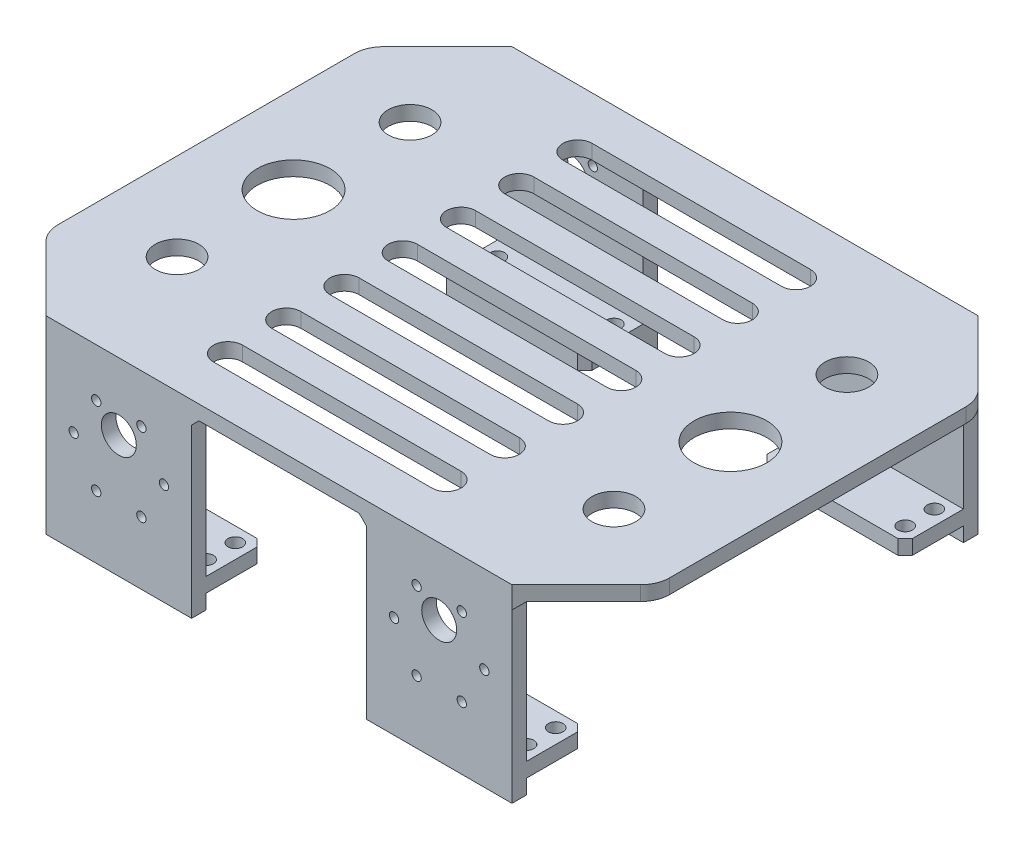
from build123d import *

# Parameters (mm, degrees)
SKETCH1_R               = 18.5
BOSS_EXTRUDE1_DEPTH     = 22.5
SKETCH2_R               = 1.6
CUT_EXTRUDE1_DEPTH      = 3.5
BOSS_EXTRUDE2_DEPTH     = 36.3
BOSS_EXTRUDE3_DEPTH     = 6.3
SKETCH4_R               = 14.5
BOSS_EXTRUDE4_DEPTH     = 37.8
SKETCH5_R               = 5
BOSS_EXTRUDE5_DEPTH     = 3
SKETCH6_R               = 1
BOSS_EXTRUDE6_DEPTH     = 9
SKETCH7_W               = 0.5
SKETCH7_H               = 3
BOSS_EXTRUDE7_DEPTH     = 6.5
CUT_EXTRUDE2_DEPTH      = 0.5
FILLET1_R               = 0.5
CHAMFER1_SIZE           = 0.2
CUT_EXTRUDE3_DEPTH      = 67.7078706
CUT_EXTRUDE3_DEPTH_BACK = 67.7078706
SKETCH9_R               = 1.6
SKETCH10_R              = 1.6
BOSS_EXTRUDE8_DEPTH     = 10
BOSS_EXTRUDE8_2_DEPTH   = 10
BOSS_EXTRUDE8_3_DEPTH   = 10
BOSS_EXTRUDE8_4_DEPTH   = 10
BOSS_EXTRUDE8_5_DEPTH   = 10
BOSS_EXTRUDE8_6_DEPTH   = 10
SKETCH11_W              = 50
SKETCH11_H              = 60
BOSS_EXTRUDE9_DEPTH     = 5
SKETCH13_W              = 56.82563108
SKETCH13_H              = 53.984349526
CUT_EXTRUDE4_DEPTH      = 121
CUT_EXTRUDE5_DEPTH      = 54.194830576
CUT_EXTRUDE5_DEPTH_BACK = 54.194830576
SKETCH14_R              = 1.6
SKETCH14_R_2            = 6
SKETCH15_W              = 160
SKETCH15_H              = 160
BOSS_EXTRUDE10_DEPTH    = 5
CHAMFER2_SIZE           = 2.5
CHAMFER3_SIZE           = 2.5
CUT_EXTRUDE6_DEPTH      = 237.127613802
SKETCH19_W              = 25
SKETCH19_H              = 160
BOSS_EXTRUDE11_DEPTH    = 5
CHAMFER4_SIZE           = 25
SKETCH20_R              = 12.5
SKETCH20_R_2            = 7.5
CUT_EXTRUDE7_DEPTH      = 10
CHAMFER5_SIZE           = 2.5
CHAMFER6_SIZE           = 2.5
FILLET2_R               = 10
BOSS_EXTRUDE12_START    = -5
SKETCH21_W              = 50
SKETCH21_H              = 20
SKETCH21_R              = 2.5
BOSS_EXTRUDE12_DEPTH    = 5
CHAMFER7_SIZE           = 2.5


with BuildPart() as part:
    # Sketch1 → Boss-Extrude1 (new body)
    with BuildSketch(Plane.XY):
        with Locations(Location((0, 0, 0), (0, 0, 180))):
            Circle(SKETCH1_R)
    extrude(amount=BOSS_EXTRUDE1_DEPTH)

    # Sketch2 → Cut-Extrude1 (cut)
    with BuildSketch(Plane.XY.offset(22.5)):
        with Locations((-7.75, 13.423393759)):
            Circle(SKETCH2_R)
        with Locations((7.75, 13.423393759)):
            Circle(SKETCH2_R)
        with Locations((-15.5, 0)):
            Circle(SKETCH2_R)
        with Locations((-7.75, -13.423393759)):
            Circle(SKETCH2_R)
        with Locations((7.75, -13.423393759)):
            Circle(SKETCH2_R)
        with Locations((15.5, 0)):
            Circle(SKETCH2_R)
    extrude(amount=-CUT_EXTRUDE1_DEPTH, mode=Mode.SUBTRACT)

    # Sketch3 → Boss-Extrude2 (add)
    with BuildSketch(Plane.XY.offset(22.5)):
        with BuildLine():
            ThreePointArc((0, 10), (-3, 7), (0, 4))
            Line((0, 4), (0, 10))
        make_face()
        with BuildLine():
            Line((0, 10), (0, 4))
            ThreePointArc((0, 4), (2.121320344, 4.878679656), (3, 7))
            ThreePointArc((3, 7), (2.121320344, 9.121320344), (0, 10))
        make_face()
    extrude(amount=BOSS_EXTRUDE2_DEPTH)

    # Sketch3<3> → Boss-Extrude3 (add)
    with BuildSketch(Plane.XY.offset(22.5)):
        with BuildLine():
            ThreePointArc((0, 13), (-6, 7), (0, 1))
            Line((0, 1), (0, 4))
            ThreePointArc((0, 4), (-3, 7), (0, 10))
            Line((0, 10), (0, 13))
        make_face()
        with BuildLine():
            Line((0, 4), (0, 1))
            ThreePointArc((0, 1), (4.242640687, 2.757359313), (6, 7))
            ThreePointArc((6, 7), (4.242640687, 11.242640687), (0, 13))
            Line((0, 13), (0, 10))
            ThreePointArc((0, 10), (2.121320344, 9.121320344), (3, 7))
            ThreePointArc((3, 7), (2.121320344, 4.878679656), (0, 4))
        make_face()
    extrude(amount=BOSS_EXTRUDE3_DEPTH)

    # Sketch4 → Boss-Extrude4 (add)
    with BuildSketch(Plane(origin=(0, 0, 0), x_dir=(-1, 0, 0), z_dir=(0, 0, -1))):
        with Locations(Location((0, 0, 0), (0, 0, 180))):
            Circle(SKETCH4_R)
    extrude(amount=BOSS_EXTRUDE4_DEPTH)

    # Sketch5 → Boss-Extrude5 (add)
    with BuildSketch(Plane(origin=(0, 0, -37.8), x_dir=(-1, 0, 0), z_dir=(0, 0, -1))):
        Circle(SKETCH5_R)
    extrude(amount=BOSS_EXTRUDE5_DEPTH)

    # Sketch6 → Boss-Extrude6 (add)
    with BuildSketch(Plane(origin=(0, 0, -40.8), x_dir=(-1, 0, 0), z_dir=(0, 0, -1))):
        Circle(SKETCH6_R)
    extrude(amount=BOSS_EXTRUDE6_DEPTH)

    # Sketch7 → Boss-Extrude7 (add)
    with BuildSketch(Plane(origin=(0, 0, -37.8), x_dir=(-1, 0, 0), z_dir=(0, 0, -1))):
        with Locations((-11.75, 0)):
            Rectangle(SKETCH7_W, SKETCH7_H)
        with Locations((11.75, 0)):
            Rectangle(SKETCH7_W, SKETCH7_H)
    extrude(amount=BOSS_EXTRUDE7_DEPTH)

    # Sketch8 → Cut-Extrude2 (cut)
    with BuildSketch(Plane(origin=(12, 0, 0), x_dir=(0, 0, -1), z_dir=(1, 0, 0))):
        with BuildLine():
            Line((42.865122037, -0.320114275), (41.665122037, -0.320114275))
            ThreePointArc((41.665122037, -0.320114275), (41.345007763, 0), (41.665122037, 0.320114275))
            Line((41.665122037, 0.320114275), (42.865122037, 0.320114275))
            ThreePointArc((42.865122037, 0.320114275), (43.185236312, 0), (42.865122037, -0.320114275))
        make_face()
    cut_extrude2 = extrude(amount=-CUT_EXTRUDE2_DEPTH, mode=Mode.SUBTRACT)

    # Mirror2: Cut-Extrude2 across plane
    add(cut_extrude2.mirror(Plane(origin=(0, 0, 0), x_dir=(0, 0, 1), z_dir=(1, 0, 0))), mode=Mode.SUBTRACT)

    # Fillet1
    fillet1_edges = [part.edges().sort_by_distance(p)[0] for p in [
        (11.75, -1.5, -44.3),
        (11.75, 1.5, -44.3),
        (-11.75, 1.5, -44.3),
        (-11.75, -1.5, -44.3),
    ]]
    fillet(fillet1_edges, radius=FILLET1_R)

    # Chamfer1
    chamfer1_edges = [part.edges().sort_by_distance(p)[0] for p in [
        (0, 4, 58.8),
        (0, 1, 28.8),
        (18.5, 0, 22.5),
    ]]
    chamfer(chamfer1_edges, length=CHAMFER1_SIZE)

    # Sketch9 → Cut-Extrude3 (cut, two sides: drawn at the far end of the back side and taken through both)
    with BuildSketch(Plane(origin=(0, 7, 0), x_dir=(1, 0, 0), z_dir=(0, 1, 0)).offset(-CUT_EXTRUDE3_DEPTH_BACK)):
        with Locations(Location((0, -50.8, 0), (0, 0, 270))):
            Circle(SKETCH9_R)
    extrude(amount=CUT_EXTRUDE3_DEPTH + CUT_EXTRUDE3_DEPTH_BACK, mode=Mode.SUBTRACT)



with BuildPart() as body_2:
    # Sketch10 → Boss-Extrude8 (new body)
    with BuildSketch(Plane.XY.offset(22.5)):
        with Locations((-7.75, 13.423393759)):
            Circle(SKETCH10_R)
    extrude(amount=BOSS_EXTRUDE8_DEPTH)


with BuildPart() as body_3:
    # Sketch10 → Boss-Extrude8 2 (new body)
    with BuildSketch(Plane.XY.offset(22.5)):
        with Locations((-15.5, 0)):
            Circle(SKETCH10_R)
    extrude(amount=BOSS_EXTRUDE8_2_DEPTH)


with BuildPart() as body_4:
    # Sketch10 → Boss-Extrude8 3 (new body)
    with BuildSketch(Plane.XY.offset(22.5)):
        with Locations((-7.75, -13.423393759)):
            Circle(SKETCH10_R)
    extrude(amount=BOSS_EXTRUDE8_3_DEPTH)


with BuildPart() as body_5:
    # Sketch10 → Boss-Extrude8 4 (new body)
    with BuildSketch(Plane.XY.offset(22.5)):
        with Locations((7.75, -13.423393759)):
            Circle(SKETCH10_R)
    extrude(amount=BOSS_EXTRUDE8_4_DEPTH)


with BuildPart() as body_6:
    # Sketch10 → Boss-Extrude8 5 (new body)
    with BuildSketch(Plane.XY.offset(22.5)):
        with Locations((15.5, 0)):
            Circle(SKETCH10_R)
    extrude(amount=BOSS_EXTRUDE8_5_DEPTH)


with BuildPart() as body_7:
    # Sketch10 → Boss-Extrude8 6 (new body)
    with BuildSketch(Plane.XY.offset(22.5)):
        with Locations((7.75, 13.423393759)):
            Circle(SKETCH10_R)
    extrude(amount=BOSS_EXTRUDE8_6_DEPTH)


with BuildPart() as part_1:
    add(part.part)

    add(body_2.part)  # Boss-Extrude9 merges body 2

    add(body_3.part)  # Boss-Extrude9 merges body 3

    add(body_4.part)  # Boss-Extrude9 merges body 4

    add(body_5.part)  # Boss-Extrude9 merges body 5

    add(body_6.part)  # Boss-Extrude9 merges body 6

    add(body_7.part)  # Boss-Extrude9 merges body 7
    # Sketch11 → Boss-Extrude9 (add)
    with BuildSketch(Plane.XY.offset(22.5)):
        with Locations((0, -5)):
            Rectangle(SKETCH11_W, SKETCH11_H)
    extrude(amount=BOSS_EXTRUDE9_DEPTH)

    # Sketch13 → Cut-Extrude4 (cut)
    with BuildSketch(Plane(origin=(0, 0, 22.5), x_dir=(-1, 0, 0), z_dir=(0, 0, -1))):
        with Locations((0.725433588, -0.664980789)):
            Rectangle(SKETCH13_W, SKETCH13_H)
    extrude(amount=CUT_EXTRUDE4_DEPTH, mode=Mode.SUBTRACT)

    # Sketch14 → Cut-Extrude5 (cut, two sides: drawn at the far end of the back side and taken through both)
    with BuildSketch(Plane.XY.offset(27.5).offset(-CUT_EXTRUDE5_DEPTH_BACK)):
        with Locations((-7.75, 13.423393759)):
            Circle(SKETCH14_R)
        with Locations((7.75, 13.423393759)):
            Circle(SKETCH14_R)
        with Locations((-15.5, 0)):
            Circle(SKETCH14_R)
        with Locations((-7.75, -13.423393759)):
            Circle(SKETCH14_R)
        with Locations((7.75, -13.423393759)):
            Circle(SKETCH14_R)
        with Locations((15.5, 0)):
            Circle(SKETCH14_R)
        with Locations((0, 7)):
            Circle(SKETCH14_R_2)
    extrude(amount=CUT_EXTRUDE5_DEPTH + CUT_EXTRUDE5_DEPTH_BACK, mode=Mode.SUBTRACT)

    # Sketch15 → Boss-Extrude10 (add)
    with BuildSketch(Plane(origin=(0, 25, 0), x_dir=(1, 0, 0), z_dir=(0, 1, 0))):
        with Locations((55, -102.5)):
            Rectangle(SKETCH15_W, SKETCH15_H)
    extrude(amount=BOSS_EXTRUDE10_DEPTH)

    # Mirror3: part across plane


with BuildPart() as part_2:
    add(part_1.part)
    add(part_1.part.mirror(Plane.XY.offset(102.5)))

    # Mirror11: part across plane


with BuildPart() as part_3:
    add(part_2.part)
    add(part_2.part.mirror(Plane(origin=(55, 0, 0), x_dir=(0, 0, 1), z_dir=(1, 0, 0))))

    # Chamfer2
    chamfer2_edges = [part_3.edges().sort_by_distance(p)[0] for p in [
        (25, 25, 25),
        (25, 25, 180),
        (85, 25, 25),
    ]]
    chamfer(chamfer2_edges, length=CHAMFER2_SIZE)

    # Chamfer3
    chamfer3_edges = [part_3.edges().sort_by_distance(p)[0] for p in [
        (85, 25, 180),
    ]]
    chamfer(chamfer3_edges, length=CHAMFER3_SIZE)

    # Sketch18 → Cut-Extrude6 (cut, through all)
    with BuildSketch(Plane(origin=(0, 30, 0), x_dir=(1, 0, 0), z_dir=(0, 1, 0))):
        with BuildLine():
            Line((92.5, -47.5), (17.5, -47.5))
            ThreePointArc((17.5, -47.5), (12.5, -42.5), (17.5, -37.5))
            Line((17.5, -37.5), (92.5, -37.5))
            ThreePointArc((92.5, -37.5), (97.5, -42.5), (92.5, -47.5))
        make_face()
        with BuildLine():
            Line((17.5, -57.5), (92.5, -57.5))
            ThreePointArc((92.5, -57.5), (97.5, -62.5), (92.5, -67.5))
            Line((92.5, -67.5), (17.5, -67.5))
            ThreePointArc((17.5, -67.5), (12.5, -62.5), (17.5, -57.5))
        make_face()
        with BuildLine():
            Line((17.5, -77.5), (92.5, -77.5))
            ThreePointArc((92.5, -77.5), (97.5, -82.5), (92.5, -87.5))
            Line((92.5, -87.5), (17.5, -87.5))
            ThreePointArc((17.5, -87.5), (12.5, -82.5), (17.5, -77.5))
        make_face()
        with BuildLine():
            Line((17.5, -97.5), (92.5, -97.5))
            ThreePointArc((92.5, -97.5), (97.5, -102.5), (92.5, -107.5))
            Line((92.5, -107.5), (17.5, -107.5))
            ThreePointArc((17.5, -107.5), (12.5, -102.5), (17.5, -97.5))
        make_face()
        with BuildLine():
            Line((17.5, -117.5), (92.5, -117.5))
            ThreePointArc((92.5, -117.5), (97.5, -122.5), (92.5, -127.5))
            Line((92.5, -127.5), (17.5, -127.5))
            ThreePointArc((17.5, -127.5), (12.5, -122.5), (17.5, -117.5))
        make_face()
        with BuildLine():
            Line((17.5, -137.5), (92.5, -137.5))
            ThreePointArc((92.5, -137.5), (97.5, -142.5), (92.5, -147.5))
            Line((92.5, -147.5), (17.5, -147.5))
            ThreePointArc((17.5, -147.5), (12.5, -142.5), (17.5, -137.5))
        make_face()
        with BuildLine():
            Line((92.5, -167.5), (17.5, -167.5))
            ThreePointArc((17.5, -167.5), (12.5, -162.5), (17.5, -157.5))
            Line((17.5, -157.5), (92.5, -157.5))
            ThreePointArc((92.5, -157.5), (97.5, -162.5), (92.5, -167.5))
        make_face()
    extrude(amount=-CUT_EXTRUDE6_DEPTH, mode=Mode.SUBTRACT)

    # Sketch19 → Boss-Extrude11 (add)
    with BuildSketch(Plane(origin=(0, 30, 0), x_dir=(1, 0, 0), z_dir=(0, 1, 0))):
        with Locations((-37.5, -102.5)):
            Rectangle(SKETCH19_W, SKETCH19_H)
        with Locations((147.5, -102.5)):
            Rectangle(SKETCH19_W, SKETCH19_H)
    extrude(amount=-BOSS_EXTRUDE11_DEPTH)

    # Chamfer4
    chamfer4_edges = [part_3.edges().sort_by_distance(p)[0] for p in [
        (-50, 27.5, 22.5),
        (-50, 27.5, 182.5),
        (160, 27.5, 182.5),
        (160, 27.5, 22.5),
    ]]
    chamfer(chamfer4_edges, length=CHAMFER4_SIZE)

    # Sketch20 → Cut-Extrude7 (cut)
    with BuildSketch(Plane(origin=(0, 30, 0), x_dir=(1, 0, 0), z_dir=(0, 1, 0))):
        with Locations(Location((130, -102.5, 0), (0, 0, 270))):
            Circle(SKETCH20_R)
        with Locations(Location((130, -62.5, 0), (0, 0, 270))):
            Circle(SKETCH20_R_2)
        with Locations(Location((130, -142.5, 0), (0, 0, 270))):
            Circle(SKETCH20_R_2)
        with Locations(Location((-20, -142.5, 0), (0, 0, 270))):
            Circle(SKETCH20_R_2)
        with Locations(Location((-20, -102.5, 0), (0, 0, 270))):
            Circle(SKETCH20_R)
        with Locations(Location((-20, -62.5, 0), (0, 0, 270))):
            Circle(SKETCH20_R_2)
    extrude(amount=-CUT_EXTRUDE7_DEPTH, mode=Mode.SUBTRACT)

    # Chamfer5
    chamfer5_edges = [part_3.edges().sort_by_distance(p)[0] for p in [
        (108.75, 25, 177.5),
        (1.25, 25, 177.5),
        (1.25, 25, 27.5),
        (108.75, 25, 27.5),
    ]]
    chamfer(chamfer5_edges, length=CHAMFER5_SIZE)

    # Chamfer6
    chamfer6_edges = [part_3.edges().sort_by_distance(p)[0] for p in [
        (135, 25, 178.75),
        (135, 25, 26.25),
        (-25, 25, 26.25),
        (-25, 25, 178.75),
    ]]
    chamfer(chamfer6_edges, length=CHAMFER6_SIZE)

    # Fillet2
    fillet2_edges = [part_3.edges().sort_by_distance(p)[0] for p in [
        (-50, 27.5, 157.5),
        (-50, 27.5, 47.5),
        (160, 27.5, 47.5),
        (160, 27.5, 157.5),
    ]]
    fillet(fillet2_edges, radius=FILLET2_R)

    # Sketch21 → Boss-Extrude12 (add)
    # profile 1 of 4: a face of its own
    with BuildSketch(Plane.XZ.offset(35).offset(BOSS_EXTRUDE12_START)):
        with Locations((110, 37.5)):
            Rectangle(SKETCH21_W, SKETCH21_H)
        with Locations(Location((90, 32.5, 0), (0, 0, 270))):
            Circle(SKETCH21_R, mode=Mode.SUBTRACT)
        with Locations(Location((90, 42.5, 0), (0, 0, 270))):
            Circle(SKETCH21_R, mode=Mode.SUBTRACT)
        with Locations(Location((130, 32.5, 0), (0, 0, 90))):
            Circle(SKETCH21_R, mode=Mode.SUBTRACT)
        with Locations(Location((130, 42.5, 0), (0, 0, 90))):
            Circle(SKETCH21_R, mode=Mode.SUBTRACT)
    # profile 2 of 4: a face of its own
    with BuildSketch(Plane.XZ.offset(35).offset(BOSS_EXTRUDE12_START)):
        with Locations((110, 167.5)):
            Rectangle(SKETCH21_W, SKETCH21_H)
        with Locations(Location((90, 162.5, 0), (0, 0, 90))):
            Circle(SKETCH21_R, mode=Mode.SUBTRACT)
        with Locations(Location((90, 172.5, 0), (0, 0, 90))):
            Circle(SKETCH21_R, mode=Mode.SUBTRACT)
        with Locations(Location((130, 172.5, 0), (0, 0, 270))):
            Circle(SKETCH21_R, mode=Mode.SUBTRACT)
        with Locations(Location((130, 162.5, 0), (0, 0, 270))):
            Circle(SKETCH21_R, mode=Mode.SUBTRACT)
    # profile 3 of 4: a face of its own
    with BuildSketch(Plane.XZ.offset(35).offset(BOSS_EXTRUDE12_START)):
        with Locations((0, 167.5)):
            Rectangle(SKETCH21_W, SKETCH21_H)
        with Locations(Location((-20, 162.5, 0), (0, 0, 90))):
            Circle(SKETCH21_R, mode=Mode.SUBTRACT)
        with Locations(Location((-20, 172.5, 0), (0, 0, 90))):
            Circle(SKETCH21_R, mode=Mode.SUBTRACT)
        with Locations(Location((20, 172.5, 0), (0, 0, 270))):
            Circle(SKETCH21_R, mode=Mode.SUBTRACT)
        with Locations(Location((20, 162.5, 0), (0, 0, 270))):
            Circle(SKETCH21_R, mode=Mode.SUBTRACT)
    # profile 4 of 4: a face of its own
    with BuildSketch(Plane.XZ.offset(35).offset(BOSS_EXTRUDE12_START)):
        with Locations((0, 37.5)):
            Rectangle(SKETCH21_W, SKETCH21_H)
        with Locations(Location((-20, 32.5, 0), (0, 0, 270))):
            Circle(SKETCH21_R, mode=Mode.SUBTRACT)
        with Locations(Location((-20, 42.5, 0), (0, 0, 270))):
            Circle(SKETCH21_R, mode=Mode.SUBTRACT)
        with Locations(Location((20, 32.5, 0), (0, 0, 90))):
            Circle(SKETCH21_R, mode=Mode.SUBTRACT)
        with Locations(Location((20, 42.5, 0), (0, 0, 90))):
            Circle(SKETCH21_R, mode=Mode.SUBTRACT)
    extrude(amount=-BOSS_EXTRUDE12_DEPTH)

    # Chamfer7
    chamfer7_edges = [part_3.edges().sort_by_distance(p)[0] for p in [
        (85, -27.5, 47.5),
        (135, -27.5, 47.5),
        (85, -27.5, 157.5),
        (135, -27.5, 157.5),
        (25, -27.5, 157.5),
        (-25, -27.5, 157.5),
        (-25, -27.5, 47.5),
        (25, -27.5, 47.5),
    ]]
    chamfer(chamfer7_edges, length=CHAMFER7_SIZE)


solid = part_3.part
